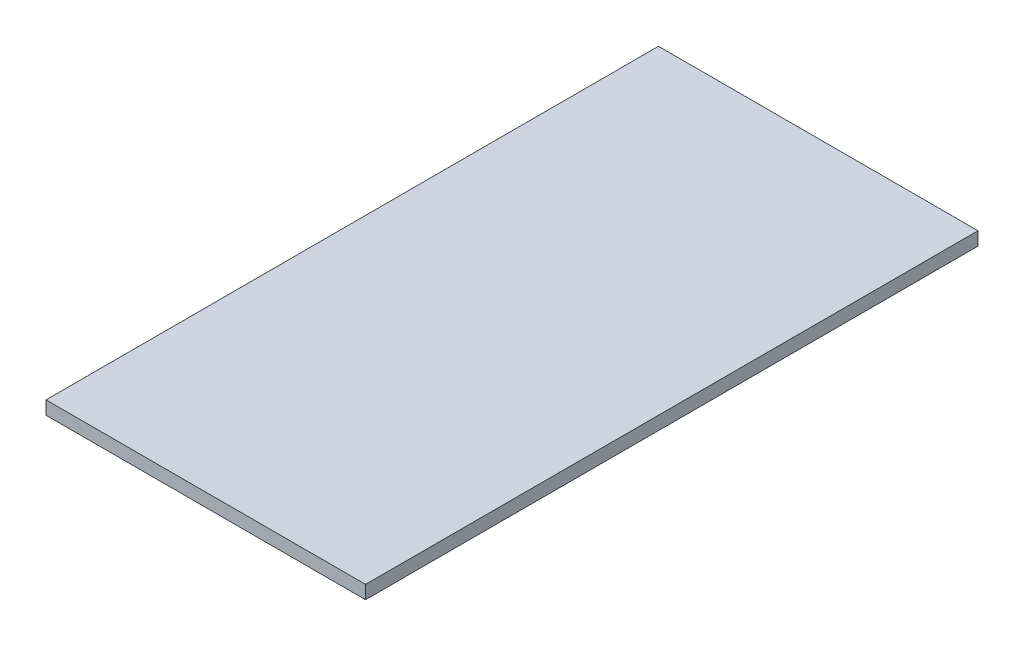
from build123d import *

# Parameters (mm, degrees)
SKETCH1_W           = 76.2
SKETCH1_H           = 146.05
BOSS_EXTRUDE1_DEPTH = 3.175


with BuildPart() as part:
    # Sketch1 → Boss-Extrude1 (new body)
    with BuildSketch(Plane(origin=(0, 0, 0), x_dir=(1, 0, 0), z_dir=(0, 1, 0))):
        with Locations((38.1, 73.025)):
            Rectangle(SKETCH1_W, SKETCH1_H)
    extrude(amount=BOSS_EXTRUDE1_DEPTH)


solid = part.part
